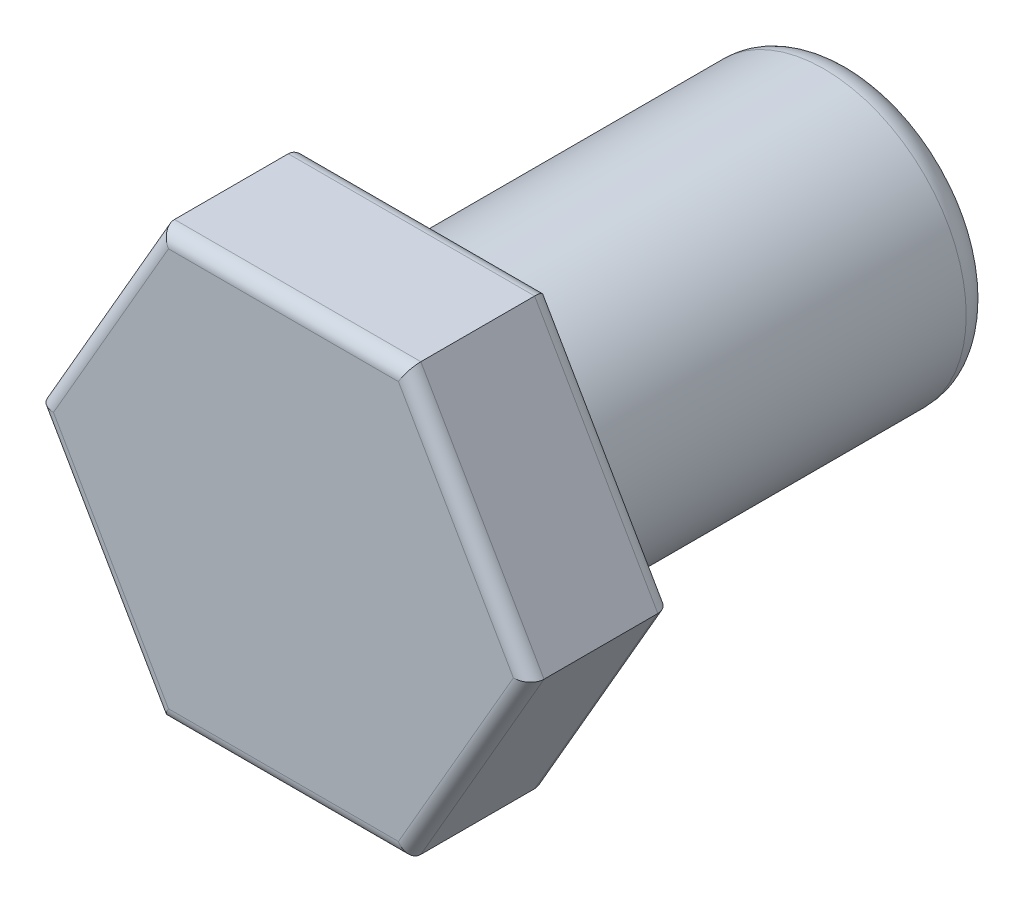
from build123d import *

# Parameters (mm, degrees)
SKETCH_1_R      = 5
EXTRUDE_1_DEPTH = 15
EXTRUDE_2_DEPTH = 5
FILLET_1_R      = 0.5
FILLET_2_R      = 1


with BuildPart() as part:
    # 草图1 → 凸台-拉伸1 (new body)
    with BuildSketch(Plane.XY):
        Circle(SKETCH_1_R)
    extrude(amount=EXTRUDE_1_DEPTH)

    # 草图2 → 凸台-拉伸2 (add)
    with BuildSketch(Plane.XY.offset(15)):
        Polygon((4.330127019, -7.5), (8.660254038, 0), (4.330127019, 7.5), (-4.330127019, 7.5), (-8.660254038, 0), (-4.330127019, -7.5), align=None)
    extrude(amount=EXTRUDE_2_DEPTH)

    # 圆角1
    fillet_1_edges = [part.edges().sort_by_distance(p)[0] for p in [
        (0, -7.5, 15),
        (6.495190528, -3.75, 15),
        (6.495190528, 3.75, 15),
        (0, 7.5, 15),
        (-6.495190528, 3.75, 15),
        (-6.495190528, -3.75, 15),
        (0, -7.5, 20),
        (6.495190528, -3.75, 20),
        (6.495190528, 3.75, 20),
        (0, 7.5, 20),
        (-6.495190528, 3.75, 20),
        (-6.495190528, -3.75, 20),
    ]]
    fillet(fillet_1_edges, radius=FILLET_1_R)

    # 圆角2
    fillet_2_edges = [part.edges().sort_by_distance(p)[0] for p in [
        (-5, 0, 0),
    ]]
    fillet(fillet_2_edges, radius=FILLET_2_R)


solid = part.part
